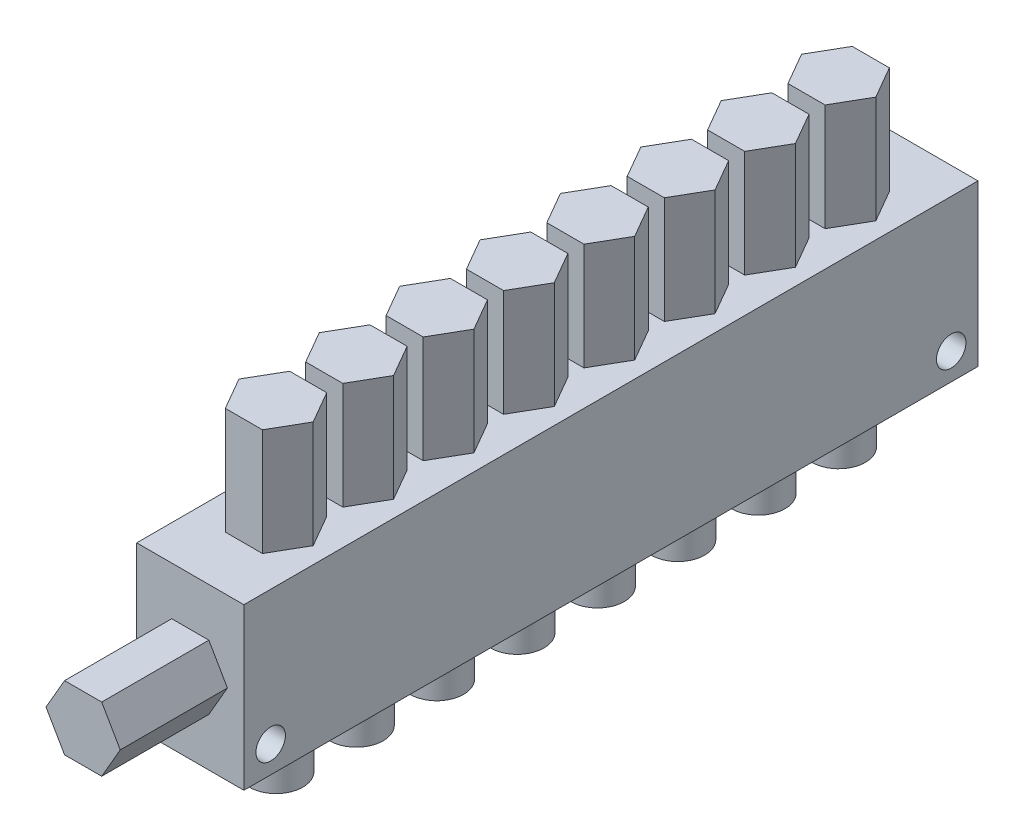
from build123d import *

# Parameters (mm, degrees)
SKETCH_1_W             = 137
SKETCH_1_H             = 30
EXTRUDE_1_DEPTH        = 10
HOLE_WIZARD_M5_1_D     = 5.5
EXTRUDE_2_DEPTH        = 20
PATTERN_LINEAR_1_COUNT = 8
PATTERN_LINEAR_1_PITCH = 15
EXTRUDE_4_DEPTH        = 20


with BuildPart() as part:
    # 草图1 → 凸台-拉伸1 (new, symmetric)
    with BuildSketch(Plane(origin=(0, 0, 0), x_dir=(0, 0, -1), z_dir=(1, 0, 0))):
        Rectangle(SKETCH_1_W, SKETCH_1_H)
    extrude(amount=EXTRUDE_1_DEPTH, both=True)

    # M5 间隙孔1 (through all)
    with Locations(Plane(origin=(10, 0, 0), x_dir=(0, 0, -1), z_dir=(1, 0, 0))):
        with Locations((-63.5, -10), (63.5, -10)):
            Hole(HOLE_WIZARD_M5_1_D / 2)

    # 草图4 → 凸台-拉伸2 (add)
    with BuildSketch(Plane(origin=(0, 15, 0), x_dir=(1, 0, 0), z_dir=(0, 1, 0))):
        Polygon((6.92820323, -52.5), (3.464101615, -46.5), (-3.464101615, -46.5), (-6.92820323, -52.5), (-3.464101615, -58.5), (3.464101615, -58.5), align=None)
    extrude_2 = extrude(amount=EXTRUDE_2_DEPTH)

    # 草图6 → 旋转1 (revolve)
    with BuildSketch(Plane(origin=(0, 0, 0), x_dir=(0, 0, -1), z_dir=(1, 0, 0)), mode=Mode.PRIVATE) as revolve_1_sk:
        Polygon((-52.5, -15), (-49.5, -15), (-49.5, -20), (-47.5, -20), (-47.5, -25), (-52.5, -25), align=None)
    revolve_1 = revolve(revolve_1_sk.sketch.rotate(Axis((0, 35, 52.5), (0, -1, 0)), 180), axis=Axis((0, 35, 52.5), (0, -1, 0)))

    # 阵列(线性)1: 凸台-拉伸2, 旋转1 ×8
    with Locations(*[(0, 0, -i * PATTERN_LINEAR_1_PITCH) for i in range(1, PATTERN_LINEAR_1_COUNT)]):
        add(extrude_2)
        add(revolve_1)

    # 草图5 → 凸台-拉伸4 (add)
    with BuildSketch(Plane.XY.offset(68.5)):
        Polygon((3.464101615, 6), (-3.464101615, 6), (-6.92820323, 0), (-3.464101615, -6), (3.464101615, -6), (6.92820323, 0), align=None)
    extrude(amount=EXTRUDE_4_DEPTH)


solid = part.part
